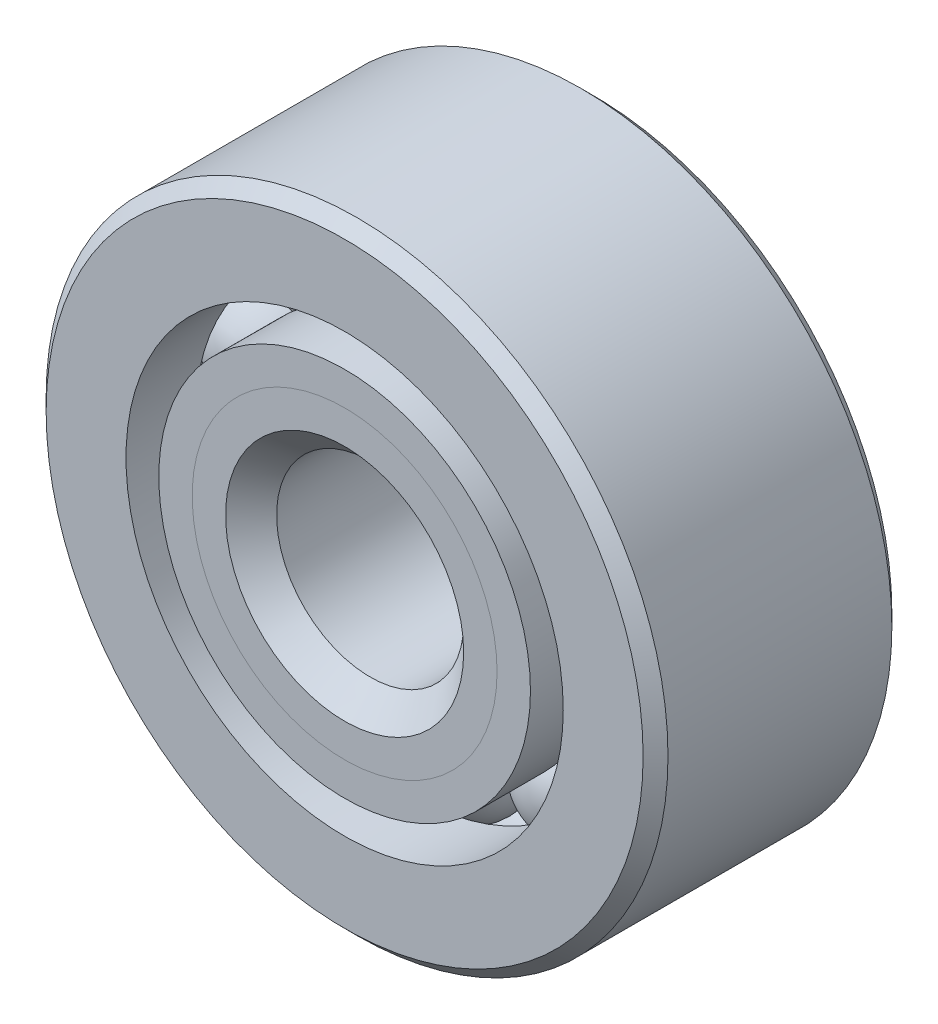
from build123d import *

# Parameters (mm, degrees)
CIRPATTERN1_COUNT = 10


with BuildPart() as part:
    # Sketch1 → Revolve1 (revolve)
    with BuildSketch(Plane(origin=(0, 0, 0), x_dir=(0, 0, -1), z_dir=(1, 0, 0)), mode=Mode.PRIVATE) as revolve1_sk:
        with BuildLine():
            Line((0.714375, 1.984375), (-0.714375, 1.984375))
            Line((-0.714375, 1.984375), (-0.79375, 1.905))
            Line((-0.79375, 1.905), (-0.79375, 1.39530783))
            Line((-0.79375, 1.39530783), (-0.352777778, 1.39530783))
            ThreePointArc((-0.352777778, 1.39530783), (0, 1.658615812), (0.352777778, 1.39530783))
            Line((0.352777778, 1.39530783), (0.79375, 1.39530783))
            Line((0.79375, 1.39530783), (0.79375, 1.905))
            Line((0.79375, 1.905), (0.714375, 1.984375))
        make_face()
    revolve(revolve1_sk.sketch.rotate(Axis((0, 0, 0.79375), (0, 0, -1)), 90), axis=Axis((0, 0, 0.79375), (0, 0, -1)))


with BuildPart() as body_2:
    # Sketch2 → Revolve2 (revolve)
    with BuildSketch(Plane(origin=(0, 0, 0), x_dir=(0, 0, -1), z_dir=(1, 0, 0)), mode=Mode.PRIVATE) as revolve2_sk:
        with BuildLine():
            Line((-0.79375, 1.18596717), (-0.352777778, 1.18596717))
            ThreePointArc((-0.352777778, 1.18596717), (-0.220104097, 0.995743918), (0, 0.922659188))
            Line((0, 0.922659188), (0, 0.759779594))
            Line((0, 0.759779594), (-0.580656212, 0.759779594))
            Line((-0.580656212, 0.759779594), (-0.79375, 0.972873382))
            Line((-0.79375, 0.972873382), (-0.79375, 1.18596717))
        make_face()
    revolve(revolve2_sk.sketch.rotate(Axis((0, 0, 0.79375), (0, 0, -1)), 90), axis=Axis((0, 0, 0.79375), (0, 0, -1)))


with BuildPart() as body_3:
    # Sketch3 → Revolve3 (revolve)
    with BuildSketch(Plane(origin=(0, 0, 0), x_dir=(0, 0, -1), z_dir=(1, 0, 0)), mode=Mode.PRIVATE) as revolve3_sk:
        with BuildLine():
            Line((-0.79375, 0.972873382), (-0.580656212, 0.759779594))
            Line((-0.580656212, 0.759779594), (0, 0.759779594))
            Line((0, 0.759779594), (0, 0.922659188))
            ThreePointArc((0, 0.922659188), (0.220104097, 0.995743918), (0.352777778, 1.18596717))
            Line((0.352777778, 1.18596717), (0.79375, 1.18596717))
            Line((0.79375, 1.18596717), (0.79375, 0.676275))
            Line((0.79375, 0.676275), (0.714375, 0.5969))
            Line((0.714375, 0.5969), (-0.630870406, 0.5969))
            Line((-0.630870406, 0.5969), (-0.79375, 0.759779594))
            Line((-0.79375, 0.759779594), (-0.79375, 0.972873382))
        make_face()
    revolve(revolve3_sk.sketch.rotate(Axis((0, 0, 0.79375), (0, 0, -1)), 90), axis=Axis((0, 0, 0.79375), (0, 0, -1)))


with BuildPart() as body_4:
    # Sketch4 → Revolve4 (revolve)
    with BuildSketch(Plane(origin=(0, 0, 0), x_dir=(0, 0, -1), z_dir=(1, 0, 0))):
        with BuildLine():
            Line((-0.367978312, 1.2906375), (0.367978312, 1.2906375))
            ThreePointArc((0.367978312, 1.2906375), (0, 1.658615812), (-0.367978312, 1.2906375))
        make_face()
    revolve(axis=Axis((0, 1.2906375, 0.367978312), (0, 0, -1)))


with BuildPart() as cirpattern1_1:
    # CirPattern1: pattern copy
    add(body_4.part.rotate(Axis((0, 0, 0), (0, 0, 1)), 1 * 360 / CIRPATTERN1_COUNT))


with BuildPart() as cirpattern1_2:
    # CirPattern1: pattern copy
    add(body_4.part.rotate(Axis((0, 0, 0), (0, 0, 1)), 2 * 360 / CIRPATTERN1_COUNT))


with BuildPart() as cirpattern1_3:
    # CirPattern1: pattern copy
    add(body_4.part.rotate(Axis((0, 0, 0), (0, 0, 1)), 3 * 360 / CIRPATTERN1_COUNT))


with BuildPart() as cirpattern1_4:
    # CirPattern1: pattern copy
    add(body_4.part.rotate(Axis((0, 0, 0), (0, 0, 1)), 4 * 360 / CIRPATTERN1_COUNT))


with BuildPart() as cirpattern1_5:
    # CirPattern1: pattern copy
    add(body_4.part.rotate(Axis((0, 0, 0), (0, 0, 1)), 5 * 360 / CIRPATTERN1_COUNT))


with BuildPart() as cirpattern1_6:
    # CirPattern1: pattern copy
    add(body_4.part.rotate(Axis((0, 0, 0), (0, 0, 1)), 6 * 360 / CIRPATTERN1_COUNT))


with BuildPart() as cirpattern1_7:
    # CirPattern1: pattern copy
    add(body_4.part.rotate(Axis((0, 0, 0), (0, 0, 1)), 7 * 360 / CIRPATTERN1_COUNT))


with BuildPart() as cirpattern1_8:
    # CirPattern1: pattern copy
    add(body_4.part.rotate(Axis((0, 0, 0), (0, 0, 1)), 8 * 360 / CIRPATTERN1_COUNT))


with BuildPart() as cirpattern1_9:
    # CirPattern1: pattern copy
    add(body_4.part.rotate(Axis((0, 0, 0), (0, 0, 1)), 9 * 360 / CIRPATTERN1_COUNT))


solid = Compound([part.part, body_2.part, body_3.part, body_4.part, cirpattern1_1.part, cirpattern1_2.part, cirpattern1_3.part, cirpattern1_4.part, cirpattern1_5.part, cirpattern1_6.part, cirpattern1_7.part, cirpattern1_8.part, cirpattern1_9.part])
